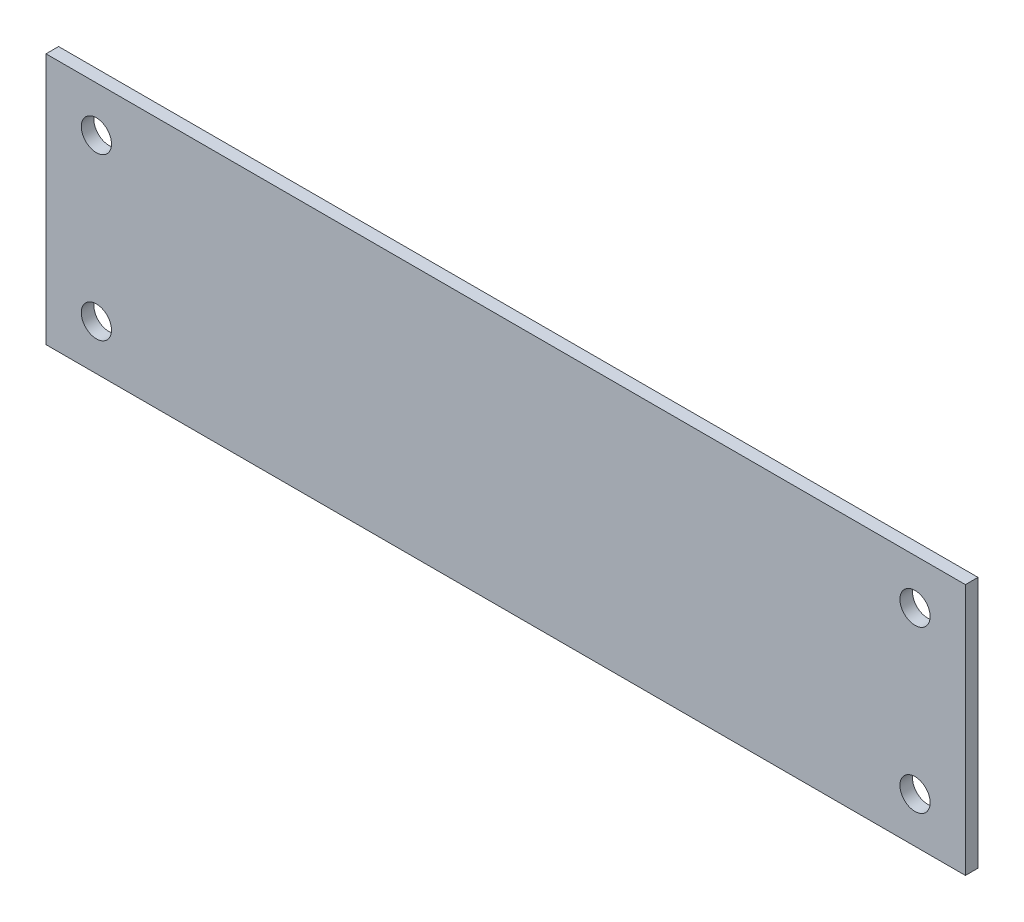
from build123d import *

# Parameters (mm, degrees)
SKETCH1_W           = 365
SKETCH1_H           = 100
SKETCH1_R           = 6
BOSS_EXTRUDE1_DEPTH = 5


with BuildPart() as part:
    # Sketch1 → Boss-Extrude1 (new body)
    with BuildSketch(Plane.XY):
        Rectangle(SKETCH1_W, SKETCH1_H)
        with Locations((162.5, 32)):
            Circle(SKETCH1_R, mode=Mode.SUBTRACT)
        with Locations((162.5, -32)):
            Circle(SKETCH1_R, mode=Mode.SUBTRACT)
        with Locations((-162.5, 32)):
            Circle(SKETCH1_R, mode=Mode.SUBTRACT)
        with Locations((-162.5, -32)):
            Circle(SKETCH1_R, mode=Mode.SUBTRACT)
    extrude(amount=BOSS_EXTRUDE1_DEPTH)


solid = part.part
